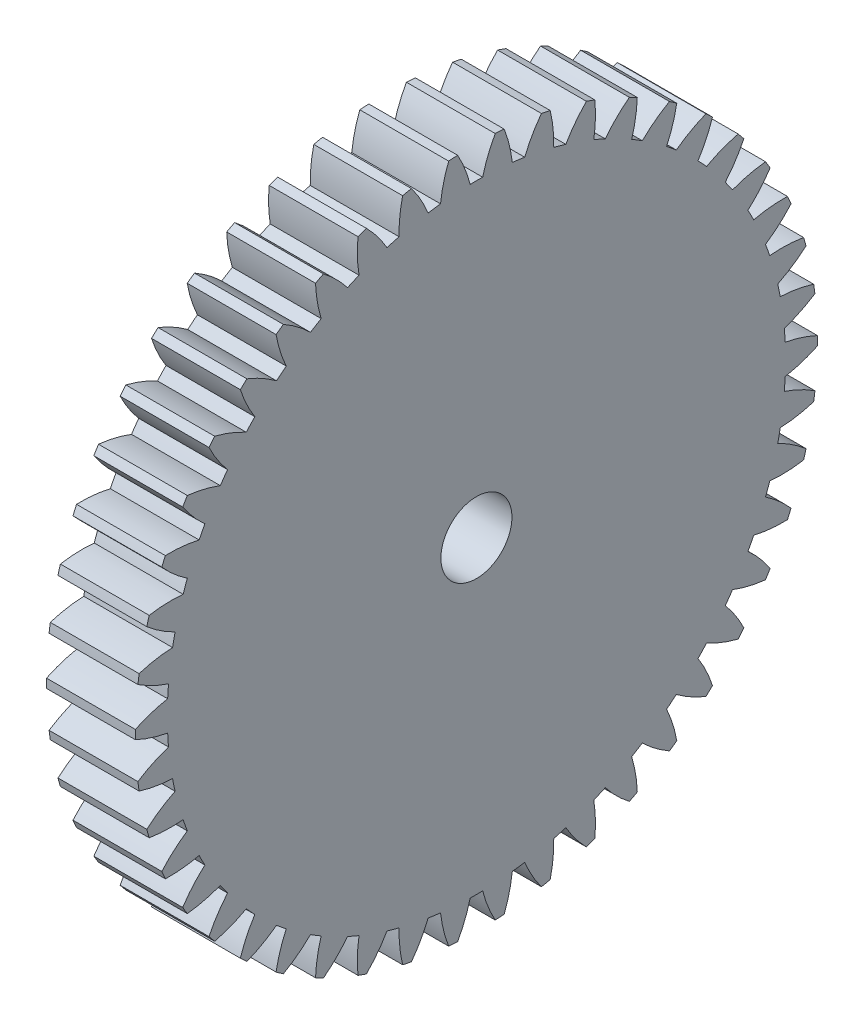
from build123d import *

# Parameters (mm, degrees)
BASPROSKE_W     = 5
BASPROSKE_H     = 19.2
TOOTHCUT_DEPTH  = 28.609418683
TEETHCUTS_COUNT = 46
TEETHCUTS_ANGLE = 352.173913043
BORSKE_R        = 2
BORE_DEPTH      = 50.0000508


with BuildPart() as part:
    # BasProSke → Base-Revolve (revolve)
    with BuildSketch(Plane(origin=(0, 0, 0), x_dir=(1, 0, 0), z_dir=(0, 1, 0)), mode=Mode.PRIVATE) as base_revolve_sk:
        with Locations((2.5, 9.6)):
            Rectangle(BASPROSKE_W, BASPROSKE_H)
    revolve(base_revolve_sk.sketch.rotate(Axis((-10, 0, 0), (1, 0, 0)), 180), axis=Axis((-10, 0, 0), (1, 0, 0)))

    # TooCutSke → ToothCut (cut, through all)
    with BuildSketch(Plane(origin=(0, 0, 0), x_dir=(0, 0, -1), z_dir=(1, 0, 0))):
        with BuildLine():
            ThreePointArc((0.352508931, 17.395428665), (0, 17.399), (-0.352508931, 17.395428665))
            ThreePointArc((-0.352508931, 17.395428665), (-0.653032583, 18.319256371), (-1.072612592, 19.195455384))
            ThreePointArc((-1.072612592, 19.195455384), (0, 19.2254), (1.072612592, 19.195455384))
            ThreePointArc((1.072612592, 19.195455384), (0.653032583, 18.319256371), (0.352508931, 17.395428665))
        make_face()
    toothcut = extrude(amount=TOOTHCUT_DEPTH, mode=Mode.SUBTRACT)

    # TeethCuts: ToothCut ×46 about axis
    teethcuts_axis = Axis((-10, 0, 0), (1, 0, 0))
    for i in range(1, TEETHCUTS_COUNT):
        add(toothcut.rotate(teethcuts_axis, i * TEETHCUTS_ANGLE / (TEETHCUTS_COUNT - 1)), mode=Mode.SUBTRACT)

    # BorSke → Bore (cut, symmetric)
    with BuildSketch(Plane(origin=(0, 0, 0), x_dir=(0, 0, -1), z_dir=(1, 0, 0))):
        with Locations(Location((0, 0, 0), (0, 0, 180))):
            Circle(BORSKE_R)
    extrude(amount=BORE_DEPTH, both=True, mode=Mode.SUBTRACT)


solid = part.part
